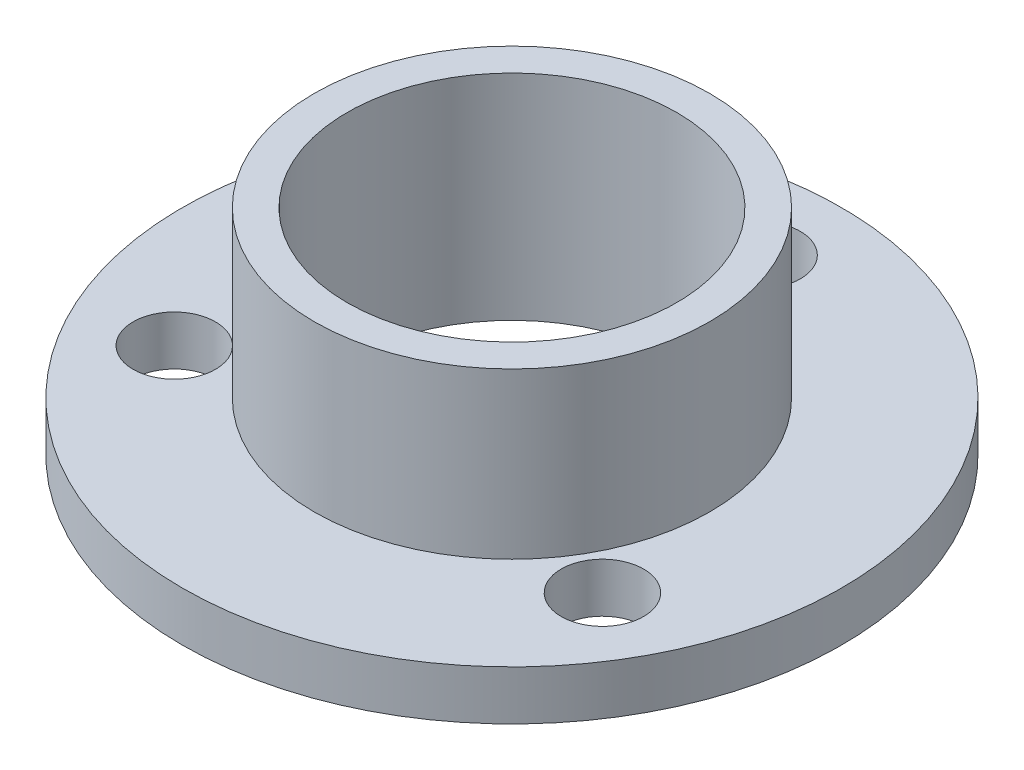
from build123d import *

# Parameters (mm, degrees)
SKETCH1_R           = 20
SKETCH1_R_2         = 2.5
SKETCH1_R_3         = 10
BOSS_EXTRUDE1_DEPTH = 3
BOSS_EXTRUDE2_START = 10
SKETCH1_3_R         = 12
SKETCH1_3_R_2       = 10
BOSS_EXTRUDE2_DEPTH = 10


with BuildPart() as part:
    # Sketch1 → Boss-Extrude1 (new body)
    with BuildSketch(Plane(origin=(0, 0, 0), x_dir=(1, 0, 0), z_dir=(0, 1, 0))):
        Circle(SKETCH1_R)
        with Locations((-12.990381057, -7.5)):
            Circle(SKETCH1_R_2, mode=Mode.SUBTRACT)
        with Locations((12.990381057, -7.5)):
            Circle(SKETCH1_R_2, mode=Mode.SUBTRACT)
        with Locations((0, 15)):
            Circle(SKETCH1_R_2, mode=Mode.SUBTRACT)
        Circle(SKETCH1_R_3, mode=Mode.SUBTRACT)
    extrude(amount=-BOSS_EXTRUDE1_DEPTH)

    # Sketch1<3> → Boss-Extrude2 (add)
    with BuildSketch(Plane(origin=(0, 0, 0), x_dir=(1, 0, 0), z_dir=(0, 1, 0)).offset(BOSS_EXTRUDE2_START)):
        Circle(SKETCH1_3_R)
        Circle(SKETCH1_3_R_2, mode=Mode.SUBTRACT)
    extrude(amount=-BOSS_EXTRUDE2_DEPTH)


solid = part.part
